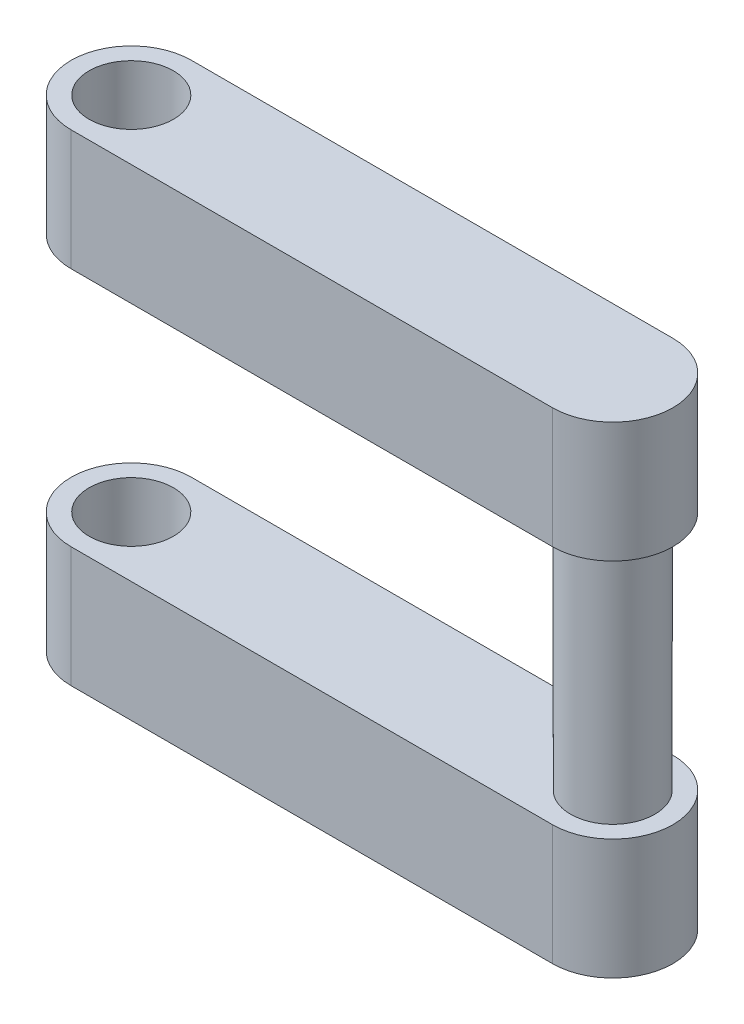
from build123d import *

# Parameters (mm, degrees)
BOSS_EXTRUDE1_DEPTH      = 20
BOSS_EXTRUDE1_DEPTH_BACK = 20
SKETCH1_R                = 3.5
BOSS_EXTRUDE2_DEPTH      = 10
BOSS_EXTRUDE3_START      = -10
BOSS_EXTRUDE3_DEPTH      = 10
CUT_EXTRUDE1_DEPTH       = 21
CUT_EXTRUDE1_DEPTH_BACK  = 22
SKETCH4_R                = 3.5
BOSS_EXTRUDE4_DEPTH      = 20
BOSS_EXTRUDE4_DEPTH_BACK = 20
SKETCH5_R                = 3.5
CUT_EXTRUDE2_DEPTH       = 23
CUT_EXTRUDE2_DEPTH_BACK  = 23
SKETCH6_R                = 3.5


with BuildPart() as part:
    # Sketch1 → Boss-Extrude1 (new, two sides: drawn at the far end of the back side and taken through both)
    with BuildSketch(Plane(origin=(0, 0, 0), x_dir=(1, 0, 0), z_dir=(0, 1, 0)).offset(-BOSS_EXTRUDE1_DEPTH_BACK)):
        with Locations((-40, 0)):
            Circle(SKETCH1_R)
    extrude(amount=BOSS_EXTRUDE1_DEPTH + BOSS_EXTRUDE1_DEPTH_BACK)

    # Sketch2 → Boss-Extrude2 (add)
    with BuildSketch(Plane(origin=(0, 20, 0), x_dir=(1, 0, 0), z_dir=(0, 1, 0))):
        with BuildLine():
            Line((-40, 5), (0, 5))
            ThreePointArc((0, 5), (5, 0), (0, -5))
            Line((0, -5), (-40, -5))
            ThreePointArc((-40, -5), (-45, 0), (-40, 5))
        make_face()
    extrude(amount=-BOSS_EXTRUDE2_DEPTH)

    # Sketch3 → Boss-Extrude3 (add)
    with BuildSketch(Plane.XZ.offset(20).offset(BOSS_EXTRUDE3_START)):
        with BuildLine():
            Line((-40, 5), (0, 5))
            ThreePointArc((0, 5), (5, 0), (0, -5))
            Line((0, -5), (-40, -5))
            ThreePointArc((-40, -5), (-45, 0), (-40, 5))
        make_face()
    extrude(amount=BOSS_EXTRUDE3_DEPTH)

    # Sketch4 → Cut-Extrude1 (cut, two sides: drawn at the far end of the back side and taken through both)
    with BuildSketch(Plane(origin=(0, 0, 0), x_dir=(1, 0, 0), z_dir=(0, 1, 0)).offset(-CUT_EXTRUDE1_DEPTH_BACK)):
        Circle(SKETCH4_R)
    extrude(amount=CUT_EXTRUDE1_DEPTH + CUT_EXTRUDE1_DEPTH_BACK, mode=Mode.SUBTRACT)

    # Sketch5 → Boss-Extrude4 (add, two sides: drawn at the far end of the back side and taken through both)
    with BuildSketch(Plane(origin=(0, 0, 0), x_dir=(1, 0, 0), z_dir=(0, 1, 0)).offset(-BOSS_EXTRUDE4_DEPTH_BACK)):
        Circle(SKETCH5_R)
    extrude(amount=BOSS_EXTRUDE4_DEPTH + BOSS_EXTRUDE4_DEPTH_BACK)

    # Sketch6 → Cut-Extrude2 (cut, two sides: drawn at the far end of the back side and taken through both)
    with BuildSketch(Plane(origin=(0, 0, 0), x_dir=(1, 0, 0), z_dir=(0, 1, 0)).offset(-CUT_EXTRUDE2_DEPTH_BACK)):
        with Locations((-40, 0)):
            Circle(SKETCH6_R)
    extrude(amount=CUT_EXTRUDE2_DEPTH + CUT_EXTRUDE2_DEPTH_BACK, mode=Mode.SUBTRACT)


solid = part.part
